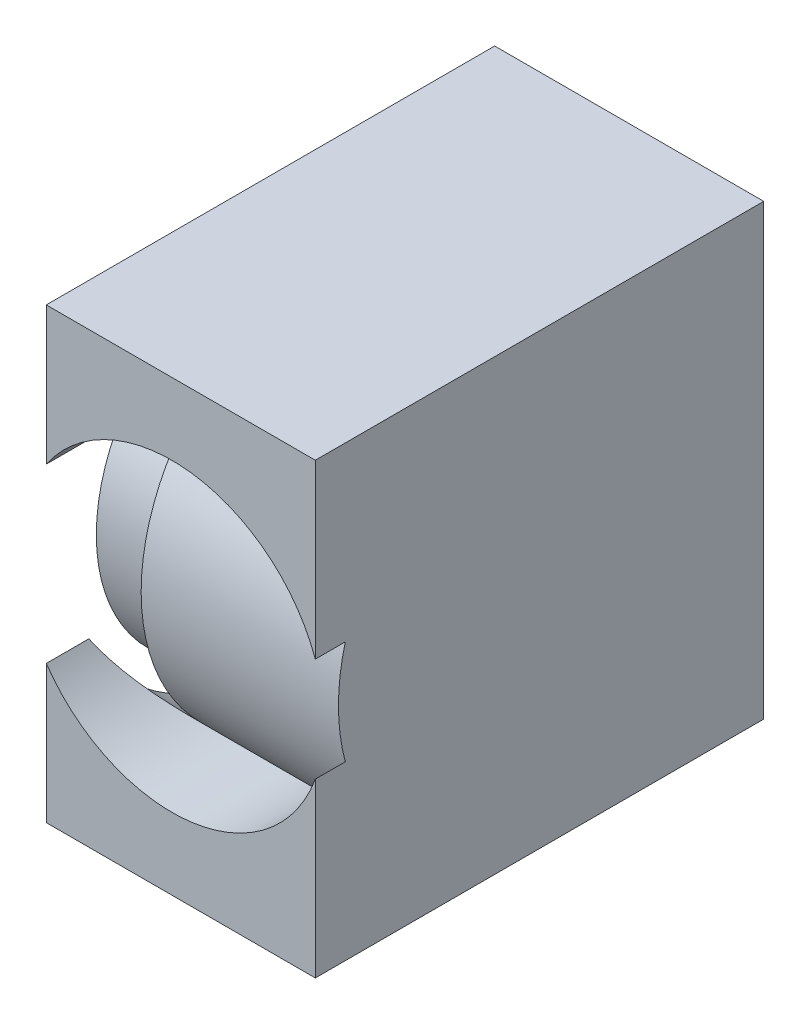
from build123d import *

# Parameters (mm, degrees)
SKETCH1_W               = 25
SKETCH1_H               = 25
BOSS_EXTRUDE1_DEPTH     = 15
SKETCH2_R               = 11.21
SKETCH2_R_2             = 9.71
CUT_EXTRUDE1_DEPTH      = 4
CUT_EXTRUDE4_REACH      = 33.721
CUT_EXTRUDE4_END_RADIUS = 11.21
SKETCH4_R               = 8.5


with BuildPart() as part:
    # Sketch1 → Boss-Extrude1 (new body)
    with BuildSketch(Plane(origin=(0, 0, 0), x_dir=(0, 0, -1), z_dir=(1, 0, 0))):
        Rectangle(SKETCH1_W, SKETCH1_H)
    extrude(amount=BOSS_EXTRUDE1_DEPTH)

    # Sketch2 → Cut-Extrude1 (cut)
    with BuildSketch(Plane.ZY):
        Circle(SKETCH2_R)
        Circle(SKETCH2_R_2, mode=Mode.SUBTRACT)
    extrude(amount=-CUT_EXTRUDE1_DEPTH, mode=Mode.SUBTRACT)

    # Cut-Extrude4: up to this cylinder (the profile starts outside it)
    cut_extrude4_end = Plane(origin=(7.008609, 0, 0), z_dir=(-1, 0, 0)) * Cylinder(CUT_EXTRUDE4_END_RADIUS, 90.862, mode=Mode.PRIVATE)
    # Sketch4 → Cut-Extrude4 (cut, up to the surface)
    with BuildSketch(Plane.XY.offset(12.5), mode=Mode.PRIVATE) as cut_extrude4_sk1:
        with Locations((7.008609298, 0)):
            Circle(SKETCH4_R)
    cut_extrude4_tool1 = extrude(cut_extrude4_sk1.sketch, amount=-CUT_EXTRUDE4_REACH, mode=Mode.PRIVATE) - cut_extrude4_end
    add(cut_extrude4_tool1.solids().sort_by_distance((7.008609, 0, 12.5))[0], mode=Mode.SUBTRACT)


solid = part.part
